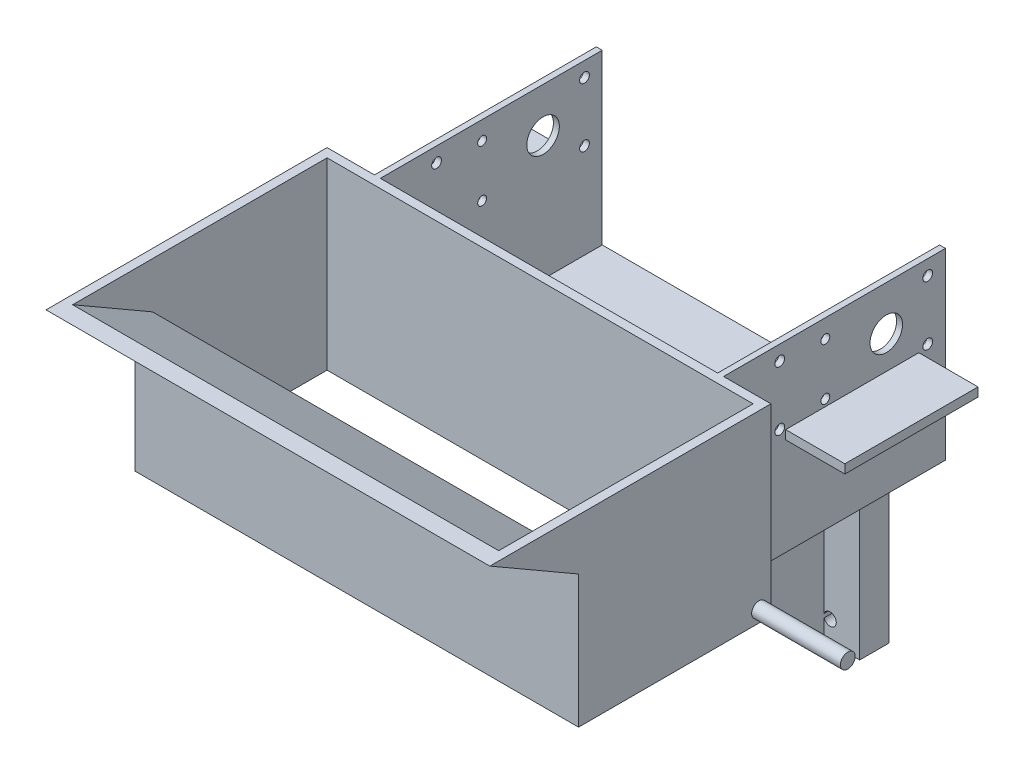
from build123d import *

# Parameters (mm, degrees)
SKETCH_1_W                   = 80
SKETCH_1_H                   = 50
EXTRUDE_1_DEPTH              = 5
HOLE_WIZARD_M5_1_D           = 4.2
HOLE_WIZARD_M5_1_DEPTH       = 11.1381927
HOLE_WIZARD_M5_1_TIP         = 1.2618073
EXTRUDE_START                = -12
SKETCH_5_W                   = 80
SKETCH_5_H                   = 50
EXTRUDE_2_DEPTH              = 2
HOLE_WIZARD_M4_1_AT_2_COUNT  = 2
HOLE_WIZARD_M4_1_AT_2_PITCH  = 20
HOLE_WIZARD_M4_1_AT_3_COUNT  = 2
HOLE_WIZARD_M4_1_AT_3_PITCH  = 50
HOLE_WIZARD_M4_1_AT_4_COUNT  = 2
HOLE_WIZARD_M4_1_AT_4_PITCH  = 53.851648071
SKETCH_11_R                  = 5.5
SKETCH_11_R_2                = 1.5
CUT_EXTRUDE_1_DEPTH          = 107.681769764
CUT_EXTRUDE_2_DEPTH          = 103.46950766
CUT_EXTRUDE_2_DEPTH_BACK     = 103.46950766
SKETCH_13_3_W                = 52
SKETCH_13_3_H                = 75
SKETCH_13_3_W_2              = 2
EXTRUDE_4_DEPTH              = 75
SKETCH_16_W                  = 80
SKETCH_16_H                  = 54
SKETCH_16_R                  = 2.1
EXTRUDE_5_DEPTH              = 10
SKETCH_17_W                  = 52
SKETCH_17_H                  = 51
CUT_EXTRUDE_4_DEPTH          = 65
SKETCH_18_W                  = 26
SKETCH_18_H                  = 5
SKETCH_18_W_2                = 2
EXTRUDE_6_DEPTH              = 75
SKETCH_19_R                  = 5.5
SKETCH_19_R_2                = 1.5
CUT_EXTRUDE_5_DEPTH          = 163.480768093
CUT_EXTRUDE_6_DEPTH          = 135.629120178
CUT_EXTRUDE_6_DEPTH_BACK     = 135.629120178
EXTRUDE_7_DEPTH              = 75
CUT_EXTRUDE_7_DEPTH          = 137.565002837
CUT_EXTRUDE_7_DEPTH_BACK     = 137.565002837
SKETCH_24_W                  = 102.975778391
SKETCH_24_H                  = 48.456033791
EXTRUDE_8_DEPTH              = 75
CUT_EXTRUDE_8_DEPTH          = 137.565002837
CUT_EXTRUDE_8_DEPTH_BACK     = 137.565002837
EXTRUDE_9_DEPTH              = 75
MIRROR_20_COPY_1_SKETCH_R    = 5.5
MIRROR_20_COPY_1_SKETCH_R_2  = 1.5
MIRROR_20_COPY_1_DEPTH       = 163.480768093
MIRROR_20_COPY_2_SKETCH_R    = 5.5
MIRROR_20_COPY_2_SKETCH_R_2  = 1.5
MIRROR_20_COPY_2_DEPTH       = 163.480768093
MIRROR_22_COPY_1_SKETCH_R    = 5.5
MIRROR_22_COPY_1_SKETCH_R_2  = 1.5
MIRROR_22_COPY_1_DEPTH       = 163.480768093
MIRROR_22_COPY_2_SKETCH_R    = 5.5
MIRROR_22_COPY_2_SKETCH_R_2  = 1.5
MIRROR_22_COPY_2_DEPTH       = 163.480768093
MIRROR_22_COPY_15_SKETCH_R   = 5.5
MIRROR_22_COPY_15_SKETCH_R_2 = 1.5
MIRROR_22_COPY_15_DEPTH      = 163.480768093
SKETCH_28_W                  = 112
SKETCH_28_H                  = 59.65855823
CUT_EXTRUDE_9_DEPTH          = 100
SKETCH_29_W                  = 150
SKETCH_29_H                  = 62.156680644
EXTRUDE_10_DEPTH             = 95
CUT_EXTRUDE_10_DEPTH         = 252.246890528
CUT_EXTRUDE_10_DEPTH_BACK    = 252.246890528
CUT_EXTRUDE_START            = -3
CUT_EXTRUDE_11_DEPTH         = 144
CUT_EXTRUDE_12_DEPTH         = 227.349287607
CUT_EXTRUDE_12_DEPTH_BACK    = 227.349287607
SKETCH_34_W                  = 45
SKETCH_34_H                  = 3
EXTRUDE_11_DEPTH             = 20
EXTRUDE_START_2              = -118
SKETCH_34_3_W                = 45
SKETCH_34_3_H                = 3
EXTRUDE_12_DEPTH             = 20
SKETCH_35_R                  = 2.5
EXTRUDE_13_DEPTH             = 30
SKETCH_36_R                  = 2.5
EXTRUDE_14_DEPTH             = 30


with BuildPart() as part:
    # 草图1 → 凸台-拉伸1 (new body)
    with BuildSketch(Plane.XY):
        Rectangle(SKETCH_1_W, SKETCH_1_H)
    extrude(amount=EXTRUDE_1_DEPTH)

    # M5 螺纹孔1
    with Locations(Plane.XY.offset(5)):
        with Locations((-30, 20), (-30, -20), (30, -20), (30, 20)):
            Hole(HOLE_WIZARD_M5_1_D / 2, depth=HOLE_WIZARD_M5_1_DEPTH)
            with Locations((0, 0, -(HOLE_WIZARD_M5_1_DEPTH + HOLE_WIZARD_M5_1_TIP / 2))):  # 118° drill point
                Cone(0, HOLE_WIZARD_M5_1_D / 2, HOLE_WIZARD_M5_1_TIP, mode=Mode.SUBTRACT)

    # 草图5 → 凸台-拉伸2 (add)
    with BuildSketch(Plane(origin=(40, 0, 0), x_dir=(0, 0, -1), z_dir=(1, 0, 0)).offset(EXTRUDE_START)):
        with Locations((-40, 0)):
            Rectangle(SKETCH_5_W, SKETCH_5_H)
    extrude_2 = extrude(amount=-EXTRUDE_2_DEPTH)

    # 草图8 → M4 螺纹孔1 (revolve, cut)
    with BuildSketch(Plane(origin=(26, 20, 11), x_dir=(0, 0, 1), z_dir=(0, 1, 0))):
        Polygon((0, 0), (0, 10.1), (1.65, 9.108579979), (1.65, 0), align=None)
    hole_wizard_m4_1 = revolve(axis=Axis((19.65, 20, 11), (1, 0, 0)), mode=Mode.SUBTRACT)

    # M4 螺纹孔1 at 2: M4 螺纹孔1 ×2
    with Locations(*[(0, -i * HOLE_WIZARD_M4_1_AT_2_PITCH, 0) for i in range(1, HOLE_WIZARD_M4_1_AT_2_COUNT)]):
        add(hole_wizard_m4_1, mode=Mode.SUBTRACT)

    # M4 螺纹孔1 at 3: M4 螺纹孔1 ×2
    with Locations(*[(0, 0, i * HOLE_WIZARD_M4_1_AT_3_PITCH) for i in range(1, HOLE_WIZARD_M4_1_AT_3_COUNT)]):
        add(hole_wizard_m4_1, mode=Mode.SUBTRACT)

    # M4 螺纹孔1 at 4: M4 螺纹孔1 ×2
    with Locations(*[Vector(0, -0.3713906763541037, 0.9284766908852594) * (i * HOLE_WIZARD_M4_1_AT_4_PITCH) for i in range(1, HOLE_WIZARD_M4_1_AT_4_COUNT)]):
        add(hole_wizard_m4_1, mode=Mode.SUBTRACT)

    # 草图11 → 切除-拉伸1 (cut, through all)
    with BuildSketch(Plane.ZY.offset(-26)):
        with Locations((25, 10)):
            Circle(SKETCH_11_R)
        with Locations((45.6, 18.75)):
            Circle(SKETCH_11_R_2)
        with Locations((45.6, 1.25)):
            Circle(SKETCH_11_R_2)
    cut_extrude_1 = extrude(amount=-CUT_EXTRUDE_1_DEPTH, mode=Mode.SUBTRACT)

    # 镜向1: 凸台-拉伸2 across plane
    add(extrude_2.mirror(Plane(origin=(0, 0, 0), x_dir=(0, 0, 1), z_dir=(1, 0, 0))))

    # 镜向2: M4 螺纹孔1, 切除-拉伸1 across plane
    add(hole_wizard_m4_1.mirror(Plane(origin=(0, 0, 0), x_dir=(0, 0, 1), z_dir=(1, 0, 0))), mode=Mode.SUBTRACT)
    add(cut_extrude_1.mirror(Plane(origin=(0, 0, 0), x_dir=(0, 0, 1), z_dir=(1, 0, 0))), mode=Mode.SUBTRACT)

    # 镜向2 copy 1 sketch → 镜向2 copy 1 (revolve, cut)
    with BuildSketch(Plane(origin=(-26, 0, 11), x_dir=(0, 0, 1), z_dir=(0, 1, 0))):
        Polygon((0, 0), (0, -10.1), (1.65, -9.108579979), (1.65, 0), align=None)
    revolve(axis=Axis((-19.65, 0, 11), (1, 0, 0)), mode=Mode.SUBTRACT)

    # 镜向2 copy 2 sketch → 镜向2 copy 2 (revolve, cut)
    with BuildSketch(Plane(origin=(-26, 20, 61), x_dir=(0, 0, 1), z_dir=(0, 1, 0))):
        Polygon((0, 0), (0, -10.1), (1.65, -9.108579979), (1.65, 0), align=None)
    revolve(axis=Axis((-19.65, 20, 61), (1, 0, 0)), mode=Mode.SUBTRACT)

    # 镜向2 copy 3 sketch → 镜向2 copy 3 (revolve, cut)
    with BuildSketch(Plane(origin=(-26, 0, 61), x_dir=(0, 0, 1), z_dir=(0, 1, 0))):
        Polygon((0, 0), (0, -10.1), (1.65, -9.108579979), (1.65, 0), align=None)
    revolve(axis=Axis((-19.65, 0, 61), (1, 0, 0)), mode=Mode.SUBTRACT)

    # 草图13 → 切除-拉伸2 (cut, two sides: drawn at the far end of the back side and taken through both)
    with BuildSketch(Plane.XZ.offset(25).offset(-CUT_EXTRUDE_2_DEPTH_BACK)):
        Polygon((-26, 5), (-28, 5), (-40, 5), (-40, 0), (40, 0), (40, 5), (28, 5), (26, 5), align=None)
        Polygon((41.874754077, 5), (40, 5), (40, 0), (-40, 0), (-40, -4.933719331), (41.874754077, -4.933719331), align=None)
    extrude(amount=CUT_EXTRUDE_2_DEPTH + CUT_EXTRUDE_2_DEPTH_BACK, mode=Mode.SUBTRACT)


with BuildPart() as cut_extrude_2_piece_1:
    # of the separate pieces the step leaves, piece 1, a body of its own (cut_extrude_2_pieces)
    add(part.part.solids().sort_by_distance((28, -25, 5))[0])



with BuildPart() as cut_extrude_2_piece_2:
    # of the separate pieces the step leaves, piece 2, a body of its own (cut_extrude_2_pieces)
    add(part.part.solids().sort_by_distance((-26, -25, 5))[0])


with BuildPart() as cut_extrude_2_piece_1_1:
    add(cut_extrude_2_piece_1.part)

    add(cut_extrude_2_piece_2.part)  # 凸台-拉伸4 merges 切除-拉伸2 piece 2
    # 草图13<3> → 凸台-拉伸4 (add)
    with BuildSketch(Plane.XZ.offset(25)):
        with Locations((0, 42.5)):
            Rectangle(SKETCH_13_3_W, SKETCH_13_3_H)
        with Locations((-27, 42.5)):
            Rectangle(SKETCH_13_3_W_2, SKETCH_13_3_H)
        with Locations((27, 42.5)):
            Rectangle(SKETCH_13_3_W_2, SKETCH_13_3_H)
    extrude(amount=EXTRUDE_4_DEPTH)

    # 草图16 → 凸台-拉伸5 (add)
    with BuildSketch(Plane(origin=(0, 0, 5), x_dir=(-1, 0, 0), z_dir=(0, 0, -1))):
        with Locations((0, -73)):
            Rectangle(SKETCH_16_W, SKETCH_16_H)
        with Locations((-30, -93)):
            Circle(SKETCH_16_R, mode=Mode.SUBTRACT)
        with Locations((30, -93)):
            Circle(SKETCH_16_R, mode=Mode.SUBTRACT)
        with Locations((-30, -53)):
            Circle(SKETCH_16_R, mode=Mode.SUBTRACT)
        with Locations((30, -53)):
            Circle(SKETCH_16_R, mode=Mode.SUBTRACT)
    extrude(amount=-EXTRUDE_5_DEPTH)

    # 草图17 → 切除-拉伸4 (cut)
    with BuildSketch(Plane.XY.offset(80)):
        with Locations((0, -74.5)):
            Rectangle(SKETCH_17_W, SKETCH_17_H)
    extrude(amount=-CUT_EXTRUDE_4_DEPTH, mode=Mode.SUBTRACT)

    # 草图18 → 凸台-拉伸6 (add)
    with BuildSketch(Plane.XY.offset(80)):
        Polygon((-28, -25), (-28, -20), (-48, -20), (-48, 25), (-50, 25), (-50, -25), align=None)
        with Locations((-13, -22.5)):
            Rectangle(SKETCH_18_W, SKETCH_18_H)
        with Locations((-27, -22.5)):
            Rectangle(SKETCH_18_W_2, SKETCH_18_H)
        with Locations((13, -22.5)):
            Rectangle(SKETCH_18_W, SKETCH_18_H)
        with Locations((27, -22.5)):
            Rectangle(SKETCH_18_W_2, SKETCH_18_H)
        Polygon((48, -20), (28, -20), (28, -25), (50, -25), (50, 25), (48, 25), align=None)
    extrude(amount=-EXTRUDE_6_DEPTH)

    # 草图19 → 切除-拉伸5 (cut, symmetric)
    with BuildSketch(Plane.ZY.offset(50)):
        with Locations((25, 10)):
            Circle(SKETCH_19_R)
        with Locations((45.6, 18.75)):
            Circle(SKETCH_19_R_2)
        with Locations((45.6, 1.25)):
            Circle(SKETCH_19_R_2)
    cut_extrude_5 = extrude(amount=CUT_EXTRUDE_5_DEPTH, both=True, mode=Mode.SUBTRACT)

    # 镜向3: M4 螺纹孔1 across plane
    add(hole_wizard_m4_1.mirror(Plane.ZY.offset(11)), mode=Mode.SUBTRACT)

    # 镜向3 copy 1 sketch → 镜向3 copy 1 (revolve, cut)
    with BuildSketch(Plane(origin=(-48, 0, 11), x_dir=(0, 0, 1), z_dir=(0, 1, 0))):
        Polygon((0, 0), (0, -10.1), (1.65, -9.108579979), (1.65, 0), align=None)
    revolve(axis=Axis((-41.65, 0, 11), (1, 0, 0)), mode=Mode.SUBTRACT)

    # 镜向3 copy 2 sketch → 镜向3 copy 2 (revolve, cut)
    with BuildSketch(Plane(origin=(-48, 20, 61), x_dir=(0, 0, 1), z_dir=(0, 1, 0))):
        Polygon((0, 0), (0, -10.1), (1.65, -9.108579979), (1.65, 0), align=None)
    revolve(axis=Axis((-41.65, 20, 61), (1, 0, 0)), mode=Mode.SUBTRACT)

    # 镜向3 copy 3 sketch → 镜向3 copy 3 (revolve, cut)
    with BuildSketch(Plane(origin=(-48, 0, 61), x_dir=(0, 0, 1), z_dir=(0, 1, 0))):
        Polygon((0, 0), (0, -10.1), (1.65, -9.108579979), (1.65, 0), align=None)
    revolve(axis=Axis((-41.65, 0, 61), (1, 0, 0)), mode=Mode.SUBTRACT)

    # 镜向4: M4 螺纹孔1 across plane
    add(hole_wizard_m4_1.mirror(Plane(origin=(38, 0, 0), x_dir=(0, 0, 1), z_dir=(1, 0, 0))), mode=Mode.SUBTRACT)

    # 镜向4 copy 1 sketch → 镜向4 copy 1 (revolve, cut)
    with BuildSketch(Plane(origin=(50, 0, 11), x_dir=(0, 0, 1), z_dir=(0, 1, 0))):
        Polygon((0, 0), (0, -10.1), (1.65, -9.108579979), (1.65, 0), align=None)
    revolve(axis=Axis((56.35, 0, 11), (1, 0, 0)), mode=Mode.SUBTRACT)

    # 镜向4 copy 2 sketch → 镜向4 copy 2 (revolve, cut)
    with BuildSketch(Plane(origin=(50, 20, 61), x_dir=(0, 0, 1), z_dir=(0, 1, 0))):
        Polygon((0, 0), (0, -10.1), (1.65, -9.108579979), (1.65, 0), align=None)
    revolve(axis=Axis((56.35, 20, 61), (1, 0, 0)), mode=Mode.SUBTRACT)

    # 镜向4 copy 3 sketch → 镜向4 copy 3 (revolve, cut)
    with BuildSketch(Plane(origin=(50, 0, 61), x_dir=(0, 0, 1), z_dir=(0, 1, 0))):
        Polygon((0, 0), (0, -10.1), (1.65, -9.108579979), (1.65, 0), align=None)
    revolve(axis=Axis((56.35, 0, 61), (1, 0, 0)), mode=Mode.SUBTRACT)

    # 草图21 → 切除-拉伸6 (cut, two sides: drawn at the far end of the back side and taken through both)
    with BuildSketch(Plane.XY.offset(80).offset(-CUT_EXTRUDE_6_DEPTH_BACK)):
        Polygon((-31.758611736, 26.765489653), (-31.758611736, -20), (32.437571978, -20), (32.437571978, 28.405937278), align=None)
    extrude(amount=CUT_EXTRUDE_6_DEPTH + CUT_EXTRUDE_6_DEPTH_BACK, mode=Mode.SUBTRACT)

    # 草图22 → 凸台-拉伸7 (add)
    with BuildSketch(Plane.XY.offset(80)):
        Polygon((-53, 25), (-55, 25), (-55, -25), (-50, -25), (-50, -20), (-53, -20), align=None)
        Polygon((55, 25), (53, 25), (53, -20), (50, -20), (50, -25), (55, -25), align=None)
        Polygon((-50, -20), (-50, -25), (-28, -25), (28, -25), (50, -25), (50, -20), (48, -20), (0, -20), (-48, -20), align=None)
    extrude(amount=-EXTRUDE_7_DEPTH)

    # 镜向8: 切除-拉伸5 across plane
    add(cut_extrude_5.mirror(Plane(origin=(-51.5, 0, 0), x_dir=(0, 0, 1), z_dir=(1, 0, 0))), mode=Mode.SUBTRACT)

    # 镜向16 copy 1 sketch → 镜向16 copy 1 (revolve, cut)
    with BuildSketch(Plane(origin=(53, 20, 11), x_dir=(0, 0, 1), z_dir=(0, 1, 0))):
        Polygon((0, 0), (0, 10.1), (1.65, 9.108579979), (1.65, 0), align=None)
    revolve(axis=Axis((46.65, 20, 11), (1, 0, 0)), mode=Mode.SUBTRACT)

    # 镜向16 copy 2 sketch → 镜向16 copy 2 (revolve, cut)
    with BuildSketch(Plane(origin=(53, 0, 11), x_dir=(0, 0, 1), z_dir=(0, 1, 0))):
        Polygon((0, 0), (0, 10.1), (1.65, 9.108579979), (1.65, 0), align=None)
    revolve(axis=Axis((46.65, 0, 11), (1, 0, 0)), mode=Mode.SUBTRACT)

    # 镜向16 copy 3 sketch → 镜向16 copy 3 (revolve, cut)
    with BuildSketch(Plane(origin=(53, 20, 61), x_dir=(0, 0, 1), z_dir=(0, 1, 0))):
        Polygon((0, 0), (0, 10.1), (1.65, 9.108579979), (1.65, 0), align=None)
    revolve(axis=Axis((46.65, 20, 61), (1, 0, 0)), mode=Mode.SUBTRACT)

    # 镜向16 copy 4 sketch → 镜向16 copy 4 (revolve, cut)
    with BuildSketch(Plane(origin=(53, 0, 61), x_dir=(0, 0, 1), z_dir=(0, 1, 0))):
        Polygon((0, 0), (0, 10.1), (1.65, 9.108579979), (1.65, 0), align=None)
    revolve(axis=Axis((46.65, 0, 61), (1, 0, 0)), mode=Mode.SUBTRACT)

    # 镜向16 copy 5 sketch → 镜向16 copy 5 (revolve, cut)
    with BuildSketch(Plane(origin=(-21, 20, 11), x_dir=(0, 0, 1), z_dir=(0, 1, 0))):
        Polygon((0, 0), (0, -10.1), (1.65, -9.108579979), (1.65, 0), align=None)
    revolve(axis=Axis((-14.65, 20, 11), (1, 0, 0)), mode=Mode.SUBTRACT)

    # 镜向16 copy 6 sketch → 镜向16 copy 6 (revolve, cut)
    with BuildSketch(Plane(origin=(-21, 0, 11), x_dir=(0, 0, 1), z_dir=(0, 1, 0))):
        Polygon((0, 0), (0, -10.1), (1.65, -9.108579979), (1.65, 0), align=None)
    revolve(axis=Axis((-14.65, 0, 11), (1, 0, 0)), mode=Mode.SUBTRACT)

    # 镜向16 copy 7 sketch → 镜向16 copy 7 (revolve, cut)
    with BuildSketch(Plane(origin=(-21, 20, 61), x_dir=(0, 0, 1), z_dir=(0, 1, 0))):
        Polygon((0, 0), (0, -10.1), (1.65, -9.108579979), (1.65, 0), align=None)
    revolve(axis=Axis((-14.65, 20, 61), (1, 0, 0)), mode=Mode.SUBTRACT)

    # 镜向16 copy 8 sketch → 镜向16 copy 8 (revolve, cut)
    with BuildSketch(Plane(origin=(-21, 0, 61), x_dir=(0, 0, 1), z_dir=(0, 1, 0))):
        Polygon((0, 0), (0, -10.1), (1.65, -9.108579979), (1.65, 0), align=None)
    revolve(axis=Axis((-14.65, 0, 61), (1, 0, 0)), mode=Mode.SUBTRACT)

    # 镜向18 copy 1 sketch → 镜向18 copy 1 (revolve, cut)
    with BuildSketch(Plane(origin=(-53, 20, 11), x_dir=(0, 0, 1), z_dir=(0, 1, 0))):
        Polygon((0, 0), (0, -10.1), (1.65, -9.108579979), (1.65, 0), align=None)
    revolve(axis=Axis((-46.65, 20, 11), (1, 0, 0)), mode=Mode.SUBTRACT)

    # 镜向18 copy 2 sketch → 镜向18 copy 2 (revolve, cut)
    with BuildSketch(Plane(origin=(-53, 0, 11), x_dir=(0, 0, 1), z_dir=(0, 1, 0))):
        Polygon((0, 0), (0, -10.1), (1.65, -9.108579979), (1.65, 0), align=None)
    revolve(axis=Axis((-46.65, 0, 11), (1, 0, 0)), mode=Mode.SUBTRACT)

    # 镜向18 copy 3 sketch → 镜向18 copy 3 (revolve, cut)
    with BuildSketch(Plane(origin=(-53, 20, 61), x_dir=(0, 0, 1), z_dir=(0, 1, 0))):
        Polygon((0, 0), (0, -10.1), (1.65, -9.108579979), (1.65, 0), align=None)
    revolve(axis=Axis((-46.65, 20, 61), (1, 0, 0)), mode=Mode.SUBTRACT)

    # 镜向18 copy 4 sketch → 镜向18 copy 4 (revolve, cut)
    with BuildSketch(Plane(origin=(-53, 0, 61), x_dir=(0, 0, 1), z_dir=(0, 1, 0))):
        Polygon((0, 0), (0, -10.1), (1.65, -9.108579979), (1.65, 0), align=None)
    revolve(axis=Axis((-46.65, 0, 61), (1, 0, 0)), mode=Mode.SUBTRACT)

    # 镜向18 copy 5 sketch → 镜向18 copy 5 (revolve, cut)
    with BuildSketch(Plane(origin=(21, 20, 11), x_dir=(0, 0, 1), z_dir=(0, 1, 0))):
        Polygon((0, 0), (0, 10.1), (1.65, 9.108579979), (1.65, 0), align=None)
    revolve(axis=Axis((14.65, 20, 11), (1, 0, 0)), mode=Mode.SUBTRACT)

    # 镜向18 copy 6 sketch → 镜向18 copy 6 (revolve, cut)
    with BuildSketch(Plane(origin=(21, 0, 11), x_dir=(0, 0, 1), z_dir=(0, 1, 0))):
        Polygon((0, 0), (0, 10.1), (1.65, 9.108579979), (1.65, 0), align=None)
    revolve(axis=Axis((14.65, 0, 11), (1, 0, 0)), mode=Mode.SUBTRACT)

    # 镜向18 copy 7 sketch → 镜向18 copy 7 (revolve, cut)
    with BuildSketch(Plane(origin=(21, 20, 61), x_dir=(0, 0, 1), z_dir=(0, 1, 0))):
        Polygon((0, 0), (0, 10.1), (1.65, 9.108579979), (1.65, 0), align=None)
    revolve(axis=Axis((14.65, 20, 61), (1, 0, 0)), mode=Mode.SUBTRACT)

    # 镜向18 copy 8 sketch → 镜向18 copy 8 (revolve, cut)
    with BuildSketch(Plane(origin=(21, 0, 61), x_dir=(0, 0, 1), z_dir=(0, 1, 0))):
        Polygon((0, 0), (0, 10.1), (1.65, 9.108579979), (1.65, 0), align=None)
    revolve(axis=Axis((14.65, 0, 61), (1, 0, 0)), mode=Mode.SUBTRACT)

    # 镜向18 copy 9 sketch → 镜向18 copy 9 (revolve, cut)
    with BuildSketch(Plane(origin=(-26, 20, 11), x_dir=(0, 0, 1), z_dir=(0, 1, 0))):
        Polygon((0, 0), (0, -10.1), (1.65, -9.108579979), (1.65, 0), align=None)
    revolve(axis=Axis((-19.65, 20, 11), (1, 0, 0)), mode=Mode.SUBTRACT)

    # 镜向18 copy 10 sketch → 镜向18 copy 10 (revolve, cut)
    with BuildSketch(Plane(origin=(-26, 0, 11), x_dir=(0, 0, 1), z_dir=(0, 1, 0))):
        Polygon((0, 0), (0, -10.1), (1.65, -9.108579979), (1.65, 0), align=None)
    revolve(axis=Axis((-19.65, 0, 11), (1, 0, 0)), mode=Mode.SUBTRACT)

    # 镜向18 copy 11 sketch → 镜向18 copy 11 (revolve, cut)
    with BuildSketch(Plane(origin=(-26, 20, 61), x_dir=(0, 0, 1), z_dir=(0, 1, 0))):
        Polygon((0, 0), (0, -10.1), (1.65, -9.108579979), (1.65, 0), align=None)
    revolve(axis=Axis((-19.65, 20, 61), (1, 0, 0)), mode=Mode.SUBTRACT)

    # 镜向18 copy 12 sketch → 镜向18 copy 12 (revolve, cut)
    with BuildSketch(Plane(origin=(-26, 0, 61), x_dir=(0, 0, 1), z_dir=(0, 1, 0))):
        Polygon((0, 0), (0, -10.1), (1.65, -9.108579979), (1.65, 0), align=None)
    revolve(axis=Axis((-19.65, 0, 61), (1, 0, 0)), mode=Mode.SUBTRACT)

    # 草图24 → 切除-拉伸7 (cut, two sides: drawn at the far end of the back side and taken through both)
    with BuildSketch(Plane(origin=(0, 0, 5), x_dir=(-1, 0, 0), z_dir=(0, 0, -1)).offset(-CUT_EXTRUDE_7_DEPTH_BACK)):
        with Locations((0.012110804, 4.228016896)):
            Rectangle(SKETCH_24_W, SKETCH_24_H)
    extrude(amount=CUT_EXTRUDE_7_DEPTH + CUT_EXTRUDE_7_DEPTH_BACK, mode=Mode.SUBTRACT)

    # 草图25 → 凸台-拉伸8 (add)
    with BuildSketch(Plane(origin=(0, 0, 5), x_dir=(-1, 0, 0), z_dir=(0, 0, -1))):
        Polygon((-53, -25), (-53, -32), (53, -32), (53, -25), (55, -25), (55, -37), (-55, -37), (-55, -25), align=None)
    extrude(amount=-EXTRUDE_8_DEPTH)

    # 草图26 → 切除-拉伸8 (cut, two sides: drawn at the far end of the back side and taken through both)
    with BuildSketch(Plane(origin=(0, 0, 5), x_dir=(-1, 0, 0), z_dir=(0, 0, -1)).offset(-CUT_EXTRUDE_8_DEPTH_BACK)):
        Polygon((-53, -20), (-53, -32), (53, -32), (53, -15.706954255), (-53, -15.706954255), align=None)
    extrude(amount=CUT_EXTRUDE_8_DEPTH + CUT_EXTRUDE_8_DEPTH_BACK, mode=Mode.SUBTRACT)

    # 草图27 → 凸台-拉伸9 (add)
    with BuildSketch(Plane(origin=(0, 0, 5), x_dir=(-1, 0, 0), z_dir=(0, 0, -1))):
        Polygon((-59, 25), (-59, -37), (59, -37), (59, 25), (57, 25), (57, -32), (-57, -32), (-57, 25), align=None)
    extrude(amount=-EXTRUDE_9_DEPTH)

    # 镜向20 copy 1 sketch → 镜向20 copy 1 (cut, symmetric)
    with BuildSketch(Plane.ZY.offset(-165)):
        with Locations((25, 10)):
            Circle(MIRROR_20_COPY_1_SKETCH_R)
        with Locations((45.6, 18.75)):
            Circle(MIRROR_20_COPY_1_SKETCH_R_2)
        with Locations((45.6, 1.25)):
            Circle(MIRROR_20_COPY_1_SKETCH_R_2)
    extrude(amount=MIRROR_20_COPY_1_DEPTH, both=True, mode=Mode.SUBTRACT)

    # 镜向20 copy 2 sketch → 镜向20 copy 2 (cut, symmetric)
    with BuildSketch(Plane(origin=(162, 0, 0), x_dir=(0, 0, 1), z_dir=(1, 0, 0))):
        with Locations((25, -10)):
            Circle(MIRROR_20_COPY_2_SKETCH_R)
        with Locations((45.6, -18.75)):
            Circle(MIRROR_20_COPY_2_SKETCH_R_2)
        with Locations((45.6, -1.25)):
            Circle(MIRROR_20_COPY_2_SKETCH_R_2)
    extrude(amount=MIRROR_20_COPY_2_DEPTH, both=True, mode=Mode.SUBTRACT)

    # 镜向20 copy 3 sketch → 镜向20 copy 3 (revolve, cut)
    with BuildSketch(Plane(origin=(59, 20, 11), x_dir=(0, 0, 1), z_dir=(0, 1, 0))):
        Polygon((0, 0), (0, -10.1), (1.65, -9.108579979), (1.65, 0), align=None)
    revolve(axis=Axis((65.35, 20, 11), (1, 0, 0)), mode=Mode.SUBTRACT)

    # 镜向20 copy 4 sketch → 镜向20 copy 4 (revolve, cut)
    with BuildSketch(Plane(origin=(59, 0, 11), x_dir=(0, 0, 1), z_dir=(0, 1, 0))):
        Polygon((0, 0), (0, -10.1), (1.65, -9.108579979), (1.65, 0), align=None)
    revolve(axis=Axis((65.35, 0, 11), (1, 0, 0)), mode=Mode.SUBTRACT)

    # 镜向20 copy 5 sketch → 镜向20 copy 5 (revolve, cut)
    with BuildSketch(Plane(origin=(59, 20, 61), x_dir=(0, 0, 1), z_dir=(0, 1, 0))):
        Polygon((0, 0), (0, -10.1), (1.65, -9.108579979), (1.65, 0), align=None)
    revolve(axis=Axis((65.35, 20, 61), (1, 0, 0)), mode=Mode.SUBTRACT)

    # 镜向20 copy 6 sketch → 镜向20 copy 6 (revolve, cut)
    with BuildSketch(Plane(origin=(59, 0, 61), x_dir=(0, 0, 1), z_dir=(0, 1, 0))):
        Polygon((0, 0), (0, -10.1), (1.65, -9.108579979), (1.65, 0), align=None)
    revolve(axis=Axis((65.35, 0, 61), (1, 0, 0)), mode=Mode.SUBTRACT)

    # 镜向20 copy 7 sketch → 镜向20 copy 7 (revolve, cut)
    with BuildSketch(Plane(origin=(133, 20, 11), x_dir=(0, 0, 1), z_dir=(0, 1, 0))):
        Polygon((0, 0), (0, 10.1), (1.65, 9.108579979), (1.65, 0), align=None)
    revolve(axis=Axis((126.65, 20, 11), (1, 0, 0)), mode=Mode.SUBTRACT)

    # 镜向20 copy 8 sketch → 镜向20 copy 8 (revolve, cut)
    with BuildSketch(Plane(origin=(133, 0, 11), x_dir=(0, 0, 1), z_dir=(0, 1, 0))):
        Polygon((0, 0), (0, 10.1), (1.65, 9.108579979), (1.65, 0), align=None)
    revolve(axis=Axis((126.65, 0, 11), (1, 0, 0)), mode=Mode.SUBTRACT)

    # 镜向20 copy 9 sketch → 镜向20 copy 9 (revolve, cut)
    with BuildSketch(Plane(origin=(133, 20, 61), x_dir=(0, 0, 1), z_dir=(0, 1, 0))):
        Polygon((0, 0), (0, 10.1), (1.65, 9.108579979), (1.65, 0), align=None)
    revolve(axis=Axis((126.65, 20, 61), (1, 0, 0)), mode=Mode.SUBTRACT)

    # 镜向20 copy 10 sketch → 镜向20 copy 10 (revolve, cut)
    with BuildSketch(Plane(origin=(133, 0, 61), x_dir=(0, 0, 1), z_dir=(0, 1, 0))):
        Polygon((0, 0), (0, 10.1), (1.65, 9.108579979), (1.65, 0), align=None)
    revolve(axis=Axis((126.65, 0, 61), (1, 0, 0)), mode=Mode.SUBTRACT)

    # 镜向20 copy 11 sketch → 镜向20 copy 11 (revolve, cut)
    with BuildSketch(Plane(origin=(86, 20, 11), x_dir=(0, 0, 1), z_dir=(0, 1, 0))):
        Polygon((0, 0), (0, -10.1), (1.65, -9.108579979), (1.65, 0), align=None)
    revolve(axis=Axis((92.35, 20, 11), (1, 0, 0)), mode=Mode.SUBTRACT)

    # 镜向20 copy 12 sketch → 镜向20 copy 12 (revolve, cut)
    with BuildSketch(Plane(origin=(86, 0, 11), x_dir=(0, 0, 1), z_dir=(0, 1, 0))):
        Polygon((0, 0), (0, -10.1), (1.65, -9.108579979), (1.65, 0), align=None)
    revolve(axis=Axis((92.35, 0, 11), (1, 0, 0)), mode=Mode.SUBTRACT)

    # 镜向20 copy 13 sketch → 镜向20 copy 13 (revolve, cut)
    with BuildSketch(Plane(origin=(86, 20, 61), x_dir=(0, 0, 1), z_dir=(0, 1, 0))):
        Polygon((0, 0), (0, -10.1), (1.65, -9.108579979), (1.65, 0), align=None)
    revolve(axis=Axis((92.35, 20, 61), (1, 0, 0)), mode=Mode.SUBTRACT)

    # 镜向20 copy 14 sketch → 镜向20 copy 14 (revolve, cut)
    with BuildSketch(Plane(origin=(86, 0, 61), x_dir=(0, 0, 1), z_dir=(0, 1, 0))):
        Polygon((0, 0), (0, -10.1), (1.65, -9.108579979), (1.65, 0), align=None)
    revolve(axis=Axis((92.35, 0, 61), (1, 0, 0)), mode=Mode.SUBTRACT)

    # 镜向22 copy 1 sketch → 镜向22 copy 1 (cut, symmetric)
    with BuildSketch(Plane(origin=(-165, 0, 0), x_dir=(0, 0, 1), z_dir=(1, 0, 0))):
        with Locations((25, -10)):
            Circle(MIRROR_22_COPY_1_SKETCH_R)
        with Locations((45.6, -18.75)):
            Circle(MIRROR_22_COPY_1_SKETCH_R_2)
        with Locations((45.6, -1.25)):
            Circle(MIRROR_22_COPY_1_SKETCH_R_2)
    extrude(amount=MIRROR_22_COPY_1_DEPTH, both=True, mode=Mode.SUBTRACT)

    # 镜向22 copy 2 sketch → 镜向22 copy 2 (cut, symmetric)
    with BuildSketch(Plane.ZY.offset(162)):
        with Locations((25, 10)):
            Circle(MIRROR_22_COPY_2_SKETCH_R)
        with Locations((45.6, 18.75)):
            Circle(MIRROR_22_COPY_2_SKETCH_R_2)
        with Locations((45.6, 1.25)):
            Circle(MIRROR_22_COPY_2_SKETCH_R_2)
    extrude(amount=MIRROR_22_COPY_2_DEPTH, both=True, mode=Mode.SUBTRACT)

    # 镜向22 copy 3 sketch → 镜向22 copy 3 (revolve, cut)
    with BuildSketch(Plane(origin=(-59, 20, 11), x_dir=(0, 0, 1), z_dir=(0, 1, 0))):
        Polygon((0, 0), (0, 10.1), (1.65, 9.108579979), (1.65, 0), align=None)
    revolve(axis=Axis((-65.35, 20, 11), (1, 0, 0)), mode=Mode.SUBTRACT)

    # 镜向22 copy 4 sketch → 镜向22 copy 4 (revolve, cut)
    with BuildSketch(Plane(origin=(-59, 0, 11), x_dir=(0, 0, 1), z_dir=(0, 1, 0))):
        Polygon((0, 0), (0, 10.1), (1.65, 9.108579979), (1.65, 0), align=None)
    revolve(axis=Axis((-65.35, 0, 11), (1, 0, 0)), mode=Mode.SUBTRACT)

    # 镜向22 copy 5 sketch → 镜向22 copy 5 (revolve, cut)
    with BuildSketch(Plane(origin=(-59, 20, 61), x_dir=(0, 0, 1), z_dir=(0, 1, 0))):
        Polygon((0, 0), (0, 10.1), (1.65, 9.108579979), (1.65, 0), align=None)
    revolve(axis=Axis((-65.35, 20, 61), (1, 0, 0)), mode=Mode.SUBTRACT)

    # 镜向22 copy 6 sketch → 镜向22 copy 6 (revolve, cut)
    with BuildSketch(Plane(origin=(-59, 0, 61), x_dir=(0, 0, 1), z_dir=(0, 1, 0))):
        Polygon((0, 0), (0, 10.1), (1.65, 9.108579979), (1.65, 0), align=None)
    revolve(axis=Axis((-65.35, 0, 61), (1, 0, 0)), mode=Mode.SUBTRACT)

    # 镜向22 copy 7 sketch → 镜向22 copy 7 (revolve, cut)
    with BuildSketch(Plane(origin=(-133, 20, 11), x_dir=(0, 0, 1), z_dir=(0, 1, 0))):
        Polygon((0, 0), (0, -10.1), (1.65, -9.108579979), (1.65, 0), align=None)
    revolve(axis=Axis((-126.65, 20, 11), (1, 0, 0)), mode=Mode.SUBTRACT)

    # 镜向22 copy 8 sketch → 镜向22 copy 8 (revolve, cut)
    with BuildSketch(Plane(origin=(-133, 0, 11), x_dir=(0, 0, 1), z_dir=(0, 1, 0))):
        Polygon((0, 0), (0, -10.1), (1.65, -9.108579979), (1.65, 0), align=None)
    revolve(axis=Axis((-126.65, 0, 11), (1, 0, 0)), mode=Mode.SUBTRACT)

    # 镜向22 copy 9 sketch → 镜向22 copy 9 (revolve, cut)
    with BuildSketch(Plane(origin=(-133, 20, 61), x_dir=(0, 0, 1), z_dir=(0, 1, 0))):
        Polygon((0, 0), (0, -10.1), (1.65, -9.108579979), (1.65, 0), align=None)
    revolve(axis=Axis((-126.65, 20, 61), (1, 0, 0)), mode=Mode.SUBTRACT)

    # 镜向22 copy 10 sketch → 镜向22 copy 10 (revolve, cut)
    with BuildSketch(Plane(origin=(-133, 0, 61), x_dir=(0, 0, 1), z_dir=(0, 1, 0))):
        Polygon((0, 0), (0, -10.1), (1.65, -9.108579979), (1.65, 0), align=None)
    revolve(axis=Axis((-126.65, 0, 61), (1, 0, 0)), mode=Mode.SUBTRACT)

    # 镜向22 copy 11 sketch → 镜向22 copy 11 (revolve, cut)
    with BuildSketch(Plane(origin=(-86, 20, 11), x_dir=(0, 0, 1), z_dir=(0, 1, 0))):
        Polygon((0, 0), (0, 10.1), (1.65, 9.108579979), (1.65, 0), align=None)
    revolve(axis=Axis((-92.35, 20, 11), (1, 0, 0)), mode=Mode.SUBTRACT)

    # 镜向22 copy 12 sketch → 镜向22 copy 12 (revolve, cut)
    with BuildSketch(Plane(origin=(-86, 0, 11), x_dir=(0, 0, 1), z_dir=(0, 1, 0))):
        Polygon((0, 0), (0, 10.1), (1.65, 9.108579979), (1.65, 0), align=None)
    revolve(axis=Axis((-92.35, 0, 11), (1, 0, 0)), mode=Mode.SUBTRACT)

    # 镜向22 copy 13 sketch → 镜向22 copy 13 (revolve, cut)
    with BuildSketch(Plane(origin=(-86, 20, 61), x_dir=(0, 0, 1), z_dir=(0, 1, 0))):
        Polygon((0, 0), (0, 10.1), (1.65, 9.108579979), (1.65, 0), align=None)
    revolve(axis=Axis((-92.35, 20, 61), (1, 0, 0)), mode=Mode.SUBTRACT)

    # 镜向22 copy 14 sketch → 镜向22 copy 14 (revolve, cut)
    with BuildSketch(Plane(origin=(-86, 0, 61), x_dir=(0, 0, 1), z_dir=(0, 1, 0))):
        Polygon((0, 0), (0, 10.1), (1.65, 9.108579979), (1.65, 0), align=None)
    revolve(axis=Axis((-92.35, 0, 61), (1, 0, 0)), mode=Mode.SUBTRACT)

    # 镜向22 copy 15 sketch → 镜向22 copy 15 (cut, symmetric)
    with BuildSketch(Plane(origin=(50, 0, 0), x_dir=(0, 0, 1), z_dir=(1, 0, 0))):
        with Locations((25, -10)):
            Circle(MIRROR_22_COPY_15_SKETCH_R)
        with Locations((45.6, -18.75)):
            Circle(MIRROR_22_COPY_15_SKETCH_R_2)
        with Locations((45.6, -1.25)):
            Circle(MIRROR_22_COPY_15_SKETCH_R_2)
    extrude(amount=MIRROR_22_COPY_15_DEPTH, both=True, mode=Mode.SUBTRACT)

    # 镜向22 copy 16 sketch → 镜向22 copy 16 (revolve, cut)
    with BuildSketch(Plane(origin=(-26, 20, 11), x_dir=(0, 0, 1), z_dir=(0, 1, 0))):
        Polygon((0, 0), (0, -10.1), (1.65, -9.108579979), (1.65, 0), align=None)
    revolve(axis=Axis((-19.65, 20, 11), (1, 0, 0)), mode=Mode.SUBTRACT)

    # 镜向22 copy 17 sketch → 镜向22 copy 17 (revolve, cut)
    with BuildSketch(Plane(origin=(-26, 0, 11), x_dir=(0, 0, 1), z_dir=(0, 1, 0))):
        Polygon((0, 0), (0, -10.1), (1.65, -9.108579979), (1.65, 0), align=None)
    revolve(axis=Axis((-19.65, 0, 11), (1, 0, 0)), mode=Mode.SUBTRACT)

    # 镜向22 copy 18 sketch → 镜向22 copy 18 (revolve, cut)
    with BuildSketch(Plane(origin=(-26, 20, 61), x_dir=(0, 0, 1), z_dir=(0, 1, 0))):
        Polygon((0, 0), (0, -10.1), (1.65, -9.108579979), (1.65, 0), align=None)
    revolve(axis=Axis((-19.65, 20, 61), (1, 0, 0)), mode=Mode.SUBTRACT)

    # 镜向22 copy 19 sketch → 镜向22 copy 19 (revolve, cut)
    with BuildSketch(Plane(origin=(-26, 0, 61), x_dir=(0, 0, 1), z_dir=(0, 1, 0))):
        Polygon((0, 0), (0, -10.1), (1.65, -9.108579979), (1.65, 0), align=None)
    revolve(axis=Axis((-19.65, 0, 61), (1, 0, 0)), mode=Mode.SUBTRACT)

    # 草图28 → 切除-拉伸9 (cut)
    with BuildSketch(Plane(origin=(0, 0, 5), x_dir=(-1, 0, 0), z_dir=(0, 0, -1))):
        with Locations((0, -2.170720885)):
            Rectangle(SKETCH_28_W, SKETCH_28_H)
    extrude(amount=-CUT_EXTRUDE_9_DEPTH, mode=Mode.SUBTRACT)

    # 草图29 → 凸台-拉伸10 (add)
    with BuildSketch(Plane.XY.offset(80)):
        with Locations((0, -6.078340322)):
            Rectangle(SKETCH_29_W, SKETCH_29_H)
    extrude(amount=EXTRUDE_10_DEPTH)

    # 草图30 → 切除-拉伸10 (cut, two sides: drawn at the far end of the back side and taken through both)
    with BuildSketch(Plane.ZY.offset(75).offset(-CUT_EXTRUDE_10_DEPTH_BACK)):
        Polygon((549.139391609, 241.00947846), (175, 25), (145, 7.679491924), (145, -37.156680644), (145, -469.175637564), (895.959346342, -896.518095898), (1300.098737952, -186.332979874), align=None)
    extrude(amount=CUT_EXTRUDE_10_DEPTH + CUT_EXTRUDE_10_DEPTH_BACK, mode=Mode.SUBTRACT)

    # 草图31 → 切除-拉伸11 (cut)
    with BuildSketch(Plane.ZY.offset(75).offset(CUT_EXTRUDE_START)):
        Polygon((83, 29.827532825), (177.361532128, 29.827532825), (142, 9.411542732), (142, -50.308719278), (83, -50.308719278), align=None)
    extrude(amount=-CUT_EXTRUDE_11_DEPTH, mode=Mode.SUBTRACT)

    # 草图32 → 切除-拉伸12 (cut, two sides: drawn at the far end of the back side and taken through both)
    with BuildSketch(Plane(origin=(28, 0, 0), x_dir=(0, 0, -1), z_dir=(1, 0, 0)).offset(-CUT_EXTRUDE_12_DEPTH_BACK)):
        Polygon((-80, -37.156680644), (-15, -100), (-94.548678903, -113.254821135), align=None)
    extrude(amount=CUT_EXTRUDE_12_DEPTH + CUT_EXTRUDE_12_DEPTH_BACK, mode=Mode.SUBTRACT)

    # 草图34 → 凸台-拉伸11 (add)
    with BuildSketch(Plane(origin=(59, 0, 0), x_dir=(0, 0, -1), z_dir=(1, 0, 0))):
        with Locations((-36.5, -2.55)):
            Rectangle(SKETCH_34_W, SKETCH_34_H)
    extrude(amount=EXTRUDE_11_DEPTH)

    # 草图34<3> → 凸台-拉伸12 (add)
    with BuildSketch(Plane(origin=(59, 0, 0), x_dir=(0, 0, -1), z_dir=(1, 0, 0)).offset(EXTRUDE_START_2)):
        with Locations((-36.5, -2.55)):
            Rectangle(SKETCH_34_3_W, SKETCH_34_3_H)
    extrude(amount=-EXTRUDE_12_DEPTH)

    # 草图35 → 凸台-拉伸13 (add)
    with BuildSketch(Plane(origin=(75, 0, 0), x_dir=(0, 0, -1), z_dir=(1, 0, 0))):
        with Locations(Location((-84, -33.156680644, 0), (0, 0, 270))):
            Circle(SKETCH_35_R)
    extrude(amount=EXTRUDE_13_DEPTH)

    # 草图36 → 凸台-拉伸14 (add)
    with BuildSketch(Plane.ZY.offset(75)):
        with Locations(Location((84, -33.156680644, 0), (0, 0, 270))):
            Circle(SKETCH_36_R)
    extrude(amount=EXTRUDE_14_DEPTH)


solid = cut_extrude_2_piece_1_1.part
